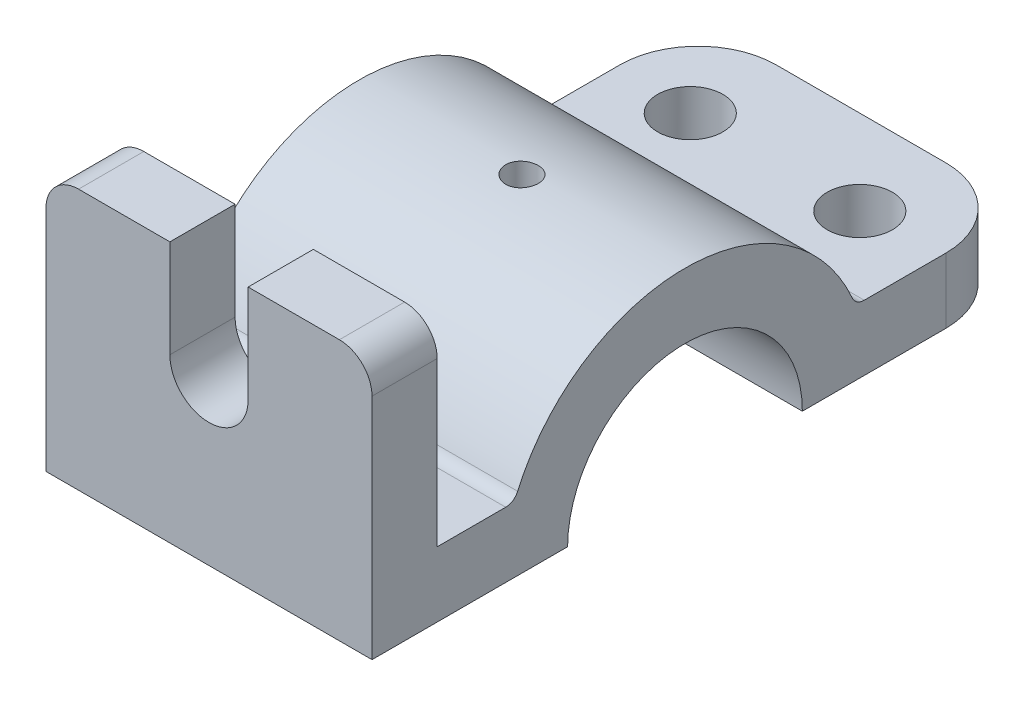
from build123d import *

# Parameters (mm, degrees)
Y_KSEKLIK_EKSTR_ZYON1_DEPTH = 50
RADYUS1_R                   = 5
KES_EKSTR_ZYON1_DEPTH       = 10
KES_EKSTR_ZYON2_REACH       = 79.382
KES_EKSTR_ZYON2_END_RADIUS  = 18
IZIM4_R                     = 2.5
IZIM5_R                     = 5
KES_EKSTR_ZYON3_DEPTH       = 26
RADYUS2_R                   = 12
RADYUS3_R                   = 2


with BuildPart() as part:
    # Çizim2 → Yükseklik-Ekstrüzyon1 (new body)
    with BuildSketch(Plane(origin=(0, 0, 0), x_dir=(0, 0, -1), z_dir=(1, 0, 0))):
        with BuildLine():
            Line((-18, 0), (-48, 0))
            Line((-48, 0), (-48, 40))
            Line((-48, 40), (-38, 40))
            Line((-38, 40), (-38, 10))
            Line((-38, 10), (-26.153393661, 10))
            ThreePointArc((-26.153393661, 10), (0, 28), (26.153393661, 10))
            Line((26.153393661, 10), (52, 10))
            Line((52, 10), (52, 0))
            Line((52, 0), (28, 0))
            Line((28, 0), (18, 0))
            ThreePointArc((18, 0), (0, 18), (-18, 0))
        make_face()
    extrude(amount=-Y_KSEKLIK_EKSTR_ZYON1_DEPTH)

    # Radyus1
    radyus1_edges = [part.edges().sort_by_distance(p)[0] for p in [
        (0, 40, 43),
        (-50, 40, 43),
    ]]
    fillet(radyus1_edges, radius=RADYUS1_R)

    # Çizim3 → Kes-Ekstrüzyon1 (cut)
    with BuildSketch(Plane.XY.offset(48)):
        with BuildLine():
            Line((-31, 40), (-31, 25))
            ThreePointArc((-31, 25), (-25, 19), (-19, 25))
            Line((-19, 25), (-19, 40))
            Line((-19, 40), (-31, 40))
        make_face()
    extrude(amount=-KES_EKSTR_ZYON1_DEPTH, mode=Mode.SUBTRACT)

    # Kes-Ekstrüzyon2: up to this cylinder (the profile starts outside it)
    kes_ekstr_zyon2_end = Plane(origin=(-25, 0, 0), z_dir=(1, 0, 0)) * Cylinder(KES_EKSTR_ZYON2_END_RADIUS, 195.764, mode=Mode.PRIVATE)
    # Çizim4 → Kes-Ekstrüzyon2 (cut, up to the surface)
    with BuildSketch(Plane(origin=(0, 28, 0), x_dir=(1, 0, 0), z_dir=(0, 1, 0)), mode=Mode.PRIVATE) as kes_ekstr_zyon2_sk1:
        with Locations(Location((-25, 0, 0), (0, 0, 270))):
            Circle(IZIM4_R)
    kes_ekstr_zyon2_tool1 = extrude(kes_ekstr_zyon2_sk1.sketch, amount=-KES_EKSTR_ZYON2_REACH, mode=Mode.PRIVATE) - kes_ekstr_zyon2_end
    add(kes_ekstr_zyon2_tool1.solids().sort_by_distance((-25, 28, 0))[0], mode=Mode.SUBTRACT)

    # Çizim5 → Kes-Ekstrüzyon3 (cut)
    with BuildSketch(Plane(origin=(0, 10, 0), x_dir=(1, 0, 0), z_dir=(0, 1, 0))):
        with Locations(Location((-38.189299203, 39, 0), (0, 0, 270))):
            Circle(IZIM5_R)
        with Locations(Location((-12.189299203, 39, 0), (0, 0, 270))):
            Circle(IZIM5_R)
    extrude(amount=-KES_EKSTR_ZYON3_DEPTH, mode=Mode.SUBTRACT)

    # Radyus2
    radyus2_edges = [part.edges().sort_by_distance(p)[0] for p in [
        (0, 5, -52),
        (-50, 5, -52),
    ]]
    fillet(radyus2_edges, radius=RADYUS2_R)

    # Radyus3
    radyus3_edges = [part.edges().sort_by_distance(p)[0] for p in [
        (-25, 10, 26.153393661),
        (-25, 10, -26.153393661),
    ]]
    fillet(radyus3_edges, radius=RADYUS3_R)


solid = part.part
